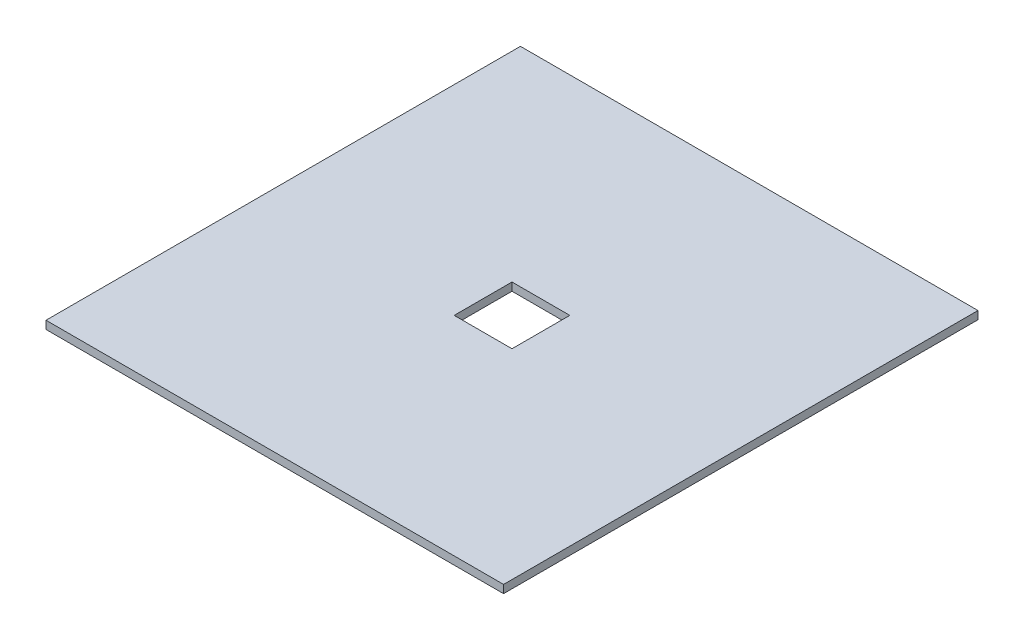
from build123d import *

# Parameters (mm, degrees)
SKETCH1_W           = 180.975
SKETCH1_H           = 187.6425
BOSS_EXTRUDE1_DEPTH = 3.175
SKETCH2_W           = 22.86
SKETCH2_H           = 22.86
CUT_EXTRUDE1_DEPTH  = 3.175


with BuildPart() as part:
    # Sketch1 → Boss-Extrude1 (new body)
    with BuildSketch(Plane(origin=(0, 0, 0), x_dir=(1, 0, 0), z_dir=(0, 1, 0))):
        Rectangle(SKETCH1_W, SKETCH1_H)
    extrude(amount=BOSS_EXTRUDE1_DEPTH)

    # Sketch2 → Cut-Extrude1 (cut)
    with BuildSketch(Plane(origin=(0, 3.175, 0), x_dir=(1, 0, 0), z_dir=(0, 1, 0))):
        Rectangle(SKETCH2_W, SKETCH2_H)
    extrude(amount=-CUT_EXTRUDE1_DEPTH, mode=Mode.SUBTRACT)


solid = part.part
